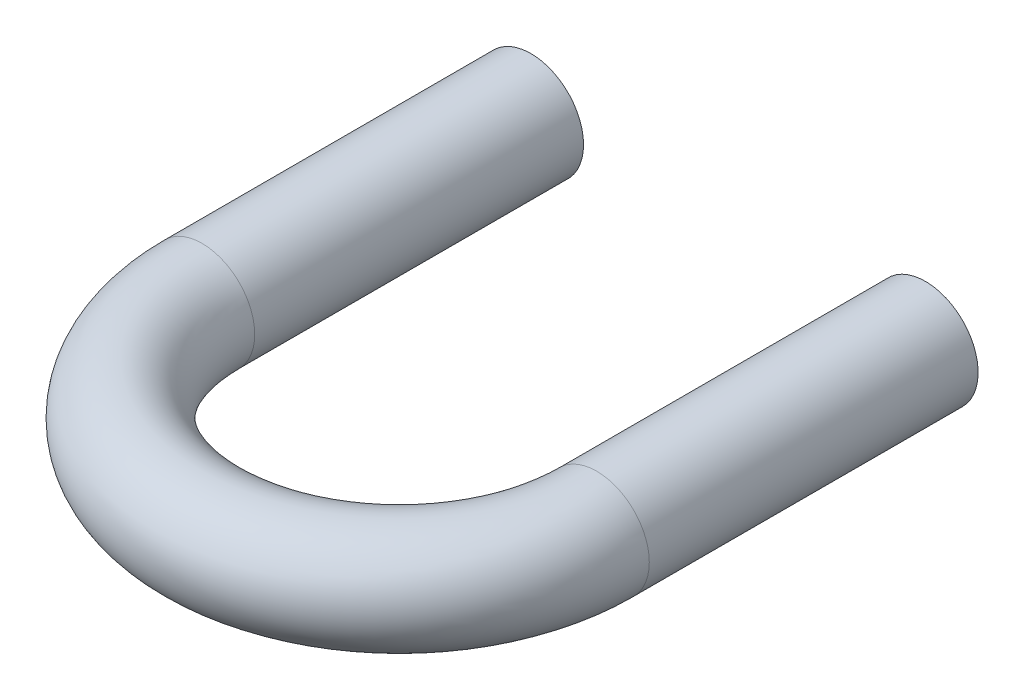
from build123d import *

# Parameters (mm, degrees)
SKETCH1_R = 4


with BuildPart() as part:
    # Sweep1: sweep along a path in Sketch2
    with BuildLine(Plane(origin=(0, 0, 0), x_dir=(1, 0, 0), z_dir=(0, 1, 0))) as sweep1_path:
        Line((-15, 0), (-15, -25))
        ThreePointArc((-15, -25), (0, -40), (15, -25))
        Line((15, -25), (15, 0))
    # Sketch1 → Sweep1 (sweep)
    with BuildSketch(Plane.XY):
        with Locations((-15, 0)):
            Circle(SKETCH1_R)
    sweep(path=sweep1_path.line)


solid = part.part
